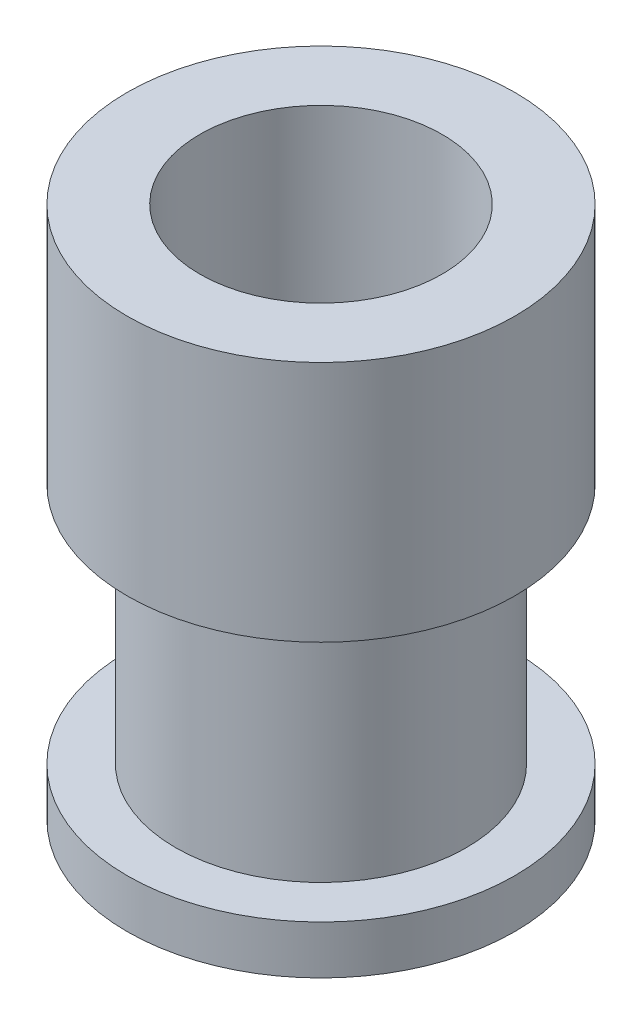
from build123d import *

# Parameters (mm, degrees)
SKETCH1_R           = 40
SKETCH1_R_2         = 25
BOSS_EXTRUDE1_DEPTH = 10
SKETCH2_R           = 30
SKETCH2_R_2         = 25
BOSS_EXTRUDE2_DEPTH = 50
SKETCH3_R           = 40
SKETCH3_R_2         = 25
BOSS_EXTRUDE3_DEPTH = 50


with BuildPart() as part:
    # Sketch1 → Boss-Extrude1 (new body)
    with BuildSketch(Plane(origin=(0, 0, 0), x_dir=(1, 0, 0), z_dir=(0, 1, 0))):
        with Locations(Location((0, 0, 0), (0, 0, 270))):
            Circle(SKETCH1_R)
        with Locations(Location((0, 0, 0), (0, 0, 270))):
            Circle(SKETCH1_R_2, mode=Mode.SUBTRACT)
    extrude(amount=BOSS_EXTRUDE1_DEPTH)

    # Sketch2 → Boss-Extrude2 (add)
    with BuildSketch(Plane(origin=(0, 10, 0), x_dir=(1, 0, 0), z_dir=(0, 1, 0))):
        with Locations(Location((0, 0, 0), (0, 0, 270))):
            Circle(SKETCH2_R)
        with Locations(Location((0, 0, 0), (0, 0, 270))):
            Circle(SKETCH2_R_2, mode=Mode.SUBTRACT)
    extrude(amount=BOSS_EXTRUDE2_DEPTH)

    # Sketch3 → Boss-Extrude3 (add)
    with BuildSketch(Plane(origin=(0, 60, 0), x_dir=(1, 0, 0), z_dir=(0, 1, 0))):
        with Locations(Location((0, 0, 0), (0, 0, 270))):
            Circle(SKETCH3_R)
        with Locations(Location((0, 0, 0), (0, 0, 270))):
            Circle(SKETCH3_R_2, mode=Mode.SUBTRACT)
    extrude(amount=BOSS_EXTRUDE3_DEPTH)


solid = part.part
